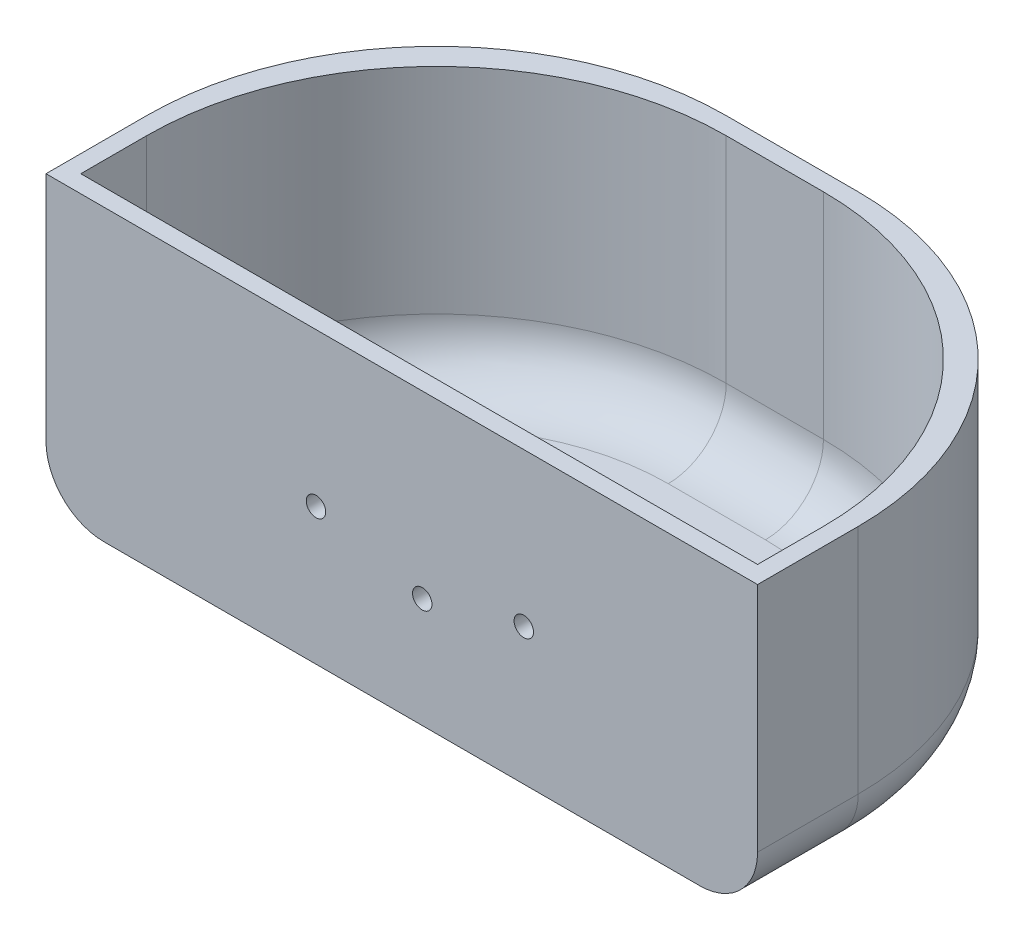
from build123d import *

# Parameters (mm, degrees)
SKETCH1_W           = 122.771416508
SKETCH1_H           = 67.364835681
BOSS_EXTRUDE1_DEPTH = 50
SKETCH2_W           = 116.771416508
SKETCH2_H           = 61.364835681
CUT_EXTRUDE1_DEPTH  = 47
SKETCH3_R           = 1.676937057
CUT_EXTRUDE3_DEPTH  = 3
FILLET7_R           = 50
FILLET8_R           = 50
FILLET9_R           = 50
FILLET10_R          = 50
FILLET11_R          = 10
FILLET12_R          = 10


with BuildPart() as part:
    # Sketch1 → Boss-Extrude1 (new body)
    with BuildSketch(Plane(origin=(0, 0, 0), x_dir=(1, 0, 0), z_dir=(0, 1, 0))):
        with Locations((61.385708254, 33.682417841)):
            Rectangle(SKETCH1_W, SKETCH1_H)
    extrude(amount=BOSS_EXTRUDE1_DEPTH)

    # Sketch2 → Cut-Extrude1 (cut)
    with BuildSketch(Plane(origin=(0, 50, 0), x_dir=(1, 0, 0), z_dir=(0, 1, 0))):
        with Locations((61.385708254, 33.682417841)):
            Rectangle(SKETCH2_W, SKETCH2_H)
    extrude(amount=-CUT_EXTRUDE1_DEPTH, mode=Mode.SUBTRACT)

    # Sketch3 → Cut-Extrude3 (cut)
    with BuildSketch(Plane.XY):
        with Locations((46.583182692, 23.569957767)):
            Circle(SKETCH3_R)
        with Locations((64.912755506, 18.942876873)):
            Circle(SKETCH3_R)
        with Locations((82.439773274, 23.569957767)):
            Circle(SKETCH3_R)
    extrude(amount=-CUT_EXTRUDE3_DEPTH, mode=Mode.SUBTRACT)

    # Fillet7
    fillet7_edges = [part.edges().sort_by_distance(p)[0] for p in [
        (119.771416508, 26.5, -64.364835681),
    ]]
    fillet(fillet7_edges, radius=FILLET7_R)

    # Fillet8
    fillet8_edges = [part.edges().sort_by_distance(p)[0] for p in [
        (122.771416508, 25, -67.364835681),
    ]]
    fillet(fillet8_edges, radius=FILLET8_R)

    # Fillet9
    fillet9_edges = [part.edges().sort_by_distance(p)[0] for p in [
        (3, 26.5, -64.364835681),
    ]]
    fillet(fillet9_edges, radius=FILLET9_R)

    # Fillet10
    fillet10_edges = [part.edges().sort_by_distance(p)[0] for p in [
        (0, 25, -67.364835681),
    ]]
    fillet(fillet10_edges, radius=FILLET10_R)

    # Fillet11
    fillet11_edges = [part.edges().sort_by_distance(p)[0] for p in [
        (119.771416508, 3, -8.682417841),
        (61.385708254, 3, -64.364835681),
        (105.126755567, 3, -49.720174741),
        (3, 3, -8.682417841),
        (17.644660941, 3, -49.720174741),
    ]]
    fillet(fillet11_edges, radius=FILLET11_R)

    # Fillet12
    fillet12_edges = [part.edges().sort_by_distance(p)[0] for p in [
        (122.771416508, 0, -8.682417841),
        (61.385708254, 0, -67.364835681),
        (108.126755567, 0, -52.720174741),
        (0, 0, -8.682417841),
        (14.644660941, 0, -52.720174741),
    ]]
    fillet(fillet12_edges, radius=FILLET12_R)


solid = part.part
